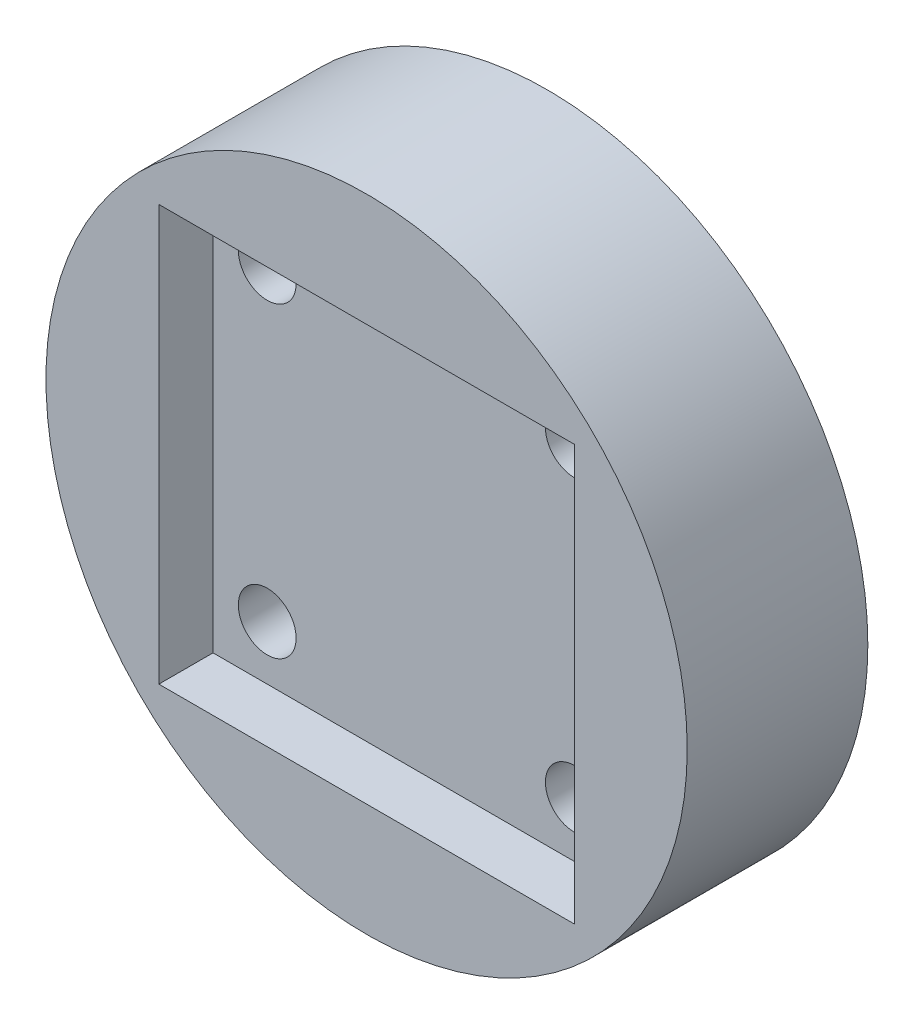
from build123d import *

# Parameters (mm, degrees)
SKETCH1_R           = 17.75
SKETCH1_W           = 23
SKETCH1_H           = 23
SKETCH1_R_2         = 1.6
BOSS_EXTRUDE1_DEPTH = 10
CUT_EXTRUDE1_START  = 10
SKETCH1_3_W         = 23
SKETCH1_3_H         = 23
SKETCH1_3_R         = 1.6
CUT_EXTRUDE1_DEPTH  = 3
SKETCH1_4_R         = 1.6
CUT_EXTRUDE3_DEPTH  = 28.020825302


with BuildPart() as part:
    # Sketch1 → Boss-Extrude1 (new body)
    # profile 1 of 6: a face of its own
    with BuildSketch(Plane(origin=(0, 0, 0), x_dir=(0, 1, 0), z_dir=(0, 0, 1))):
        with Locations(Location((0, 0, 0), (0, 0, 270))):
            Circle(SKETCH1_R)
        Rectangle(SKETCH1_W, SKETCH1_H, mode=Mode.SUBTRACT)
    # profile 2 of 6: a face of its own
    with BuildSketch(Plane(origin=(0, 0, 0), x_dir=(0, 1, 0), z_dir=(0, 0, 1))):
        Rectangle(SKETCH1_W, SKETCH1_H)
        with Locations((-8.5, -8.5)):
            Circle(SKETCH1_R_2, mode=Mode.SUBTRACT)
        with Locations((8.5, -8.5)):
            Circle(SKETCH1_R_2, mode=Mode.SUBTRACT)
        with Locations((8.5, 8.5)):
            Circle(SKETCH1_R_2, mode=Mode.SUBTRACT)
        with Locations((-8.5, 8.5)):
            Circle(SKETCH1_R_2, mode=Mode.SUBTRACT)
    # profile 3 of 6: a face of its own
    with BuildSketch(Plane(origin=(0, 0, 0), x_dir=(0, 1, 0), z_dir=(0, 0, 1))):
        with Locations((8.5, 8.5)):
            Circle(SKETCH1_R_2)
    # profile 4 of 6: a face of its own
    with BuildSketch(Plane(origin=(0, 0, 0), x_dir=(0, 1, 0), z_dir=(0, 0, 1))):
        with Locations((-8.5, 8.5)):
            Circle(SKETCH1_R_2)
    # profile 5 of 6: a face of its own
    with BuildSketch(Plane(origin=(0, 0, 0), x_dir=(0, 1, 0), z_dir=(0, 0, 1))):
        with Locations((8.5, -8.5)):
            Circle(SKETCH1_R_2)
    # profile 6 of 6: a face of its own
    with BuildSketch(Plane(origin=(0, 0, 0), x_dir=(0, 1, 0), z_dir=(0, 0, 1))):
        with Locations((-8.5, -8.5)):
            Circle(SKETCH1_R_2)
    extrude(amount=BOSS_EXTRUDE1_DEPTH)

    # Sketch1<3> → Cut-Extrude1 (cut)
    # profile 1 of 5: a face of its own
    with BuildSketch(Plane(origin=(0, 0, 0), x_dir=(0, 1, 0), z_dir=(0, 0, 1)).offset(CUT_EXTRUDE1_START)):
        Rectangle(SKETCH1_3_W, SKETCH1_3_H)
        with Locations((-8.5, -8.5)):
            Circle(SKETCH1_3_R, mode=Mode.SUBTRACT)
        with Locations((8.5, -8.5)):
            Circle(SKETCH1_3_R, mode=Mode.SUBTRACT)
        with Locations((8.5, 8.5)):
            Circle(SKETCH1_3_R, mode=Mode.SUBTRACT)
        with Locations((-8.5, 8.5)):
            Circle(SKETCH1_3_R, mode=Mode.SUBTRACT)
    # profile 2 of 5: a face of its own
    with BuildSketch(Plane(origin=(0, 0, 0), x_dir=(0, 1, 0), z_dir=(0, 0, 1)).offset(CUT_EXTRUDE1_START)):
        with Locations((-8.5, 8.5)):
            Circle(SKETCH1_3_R)
    # profile 3 of 5: a face of its own
    with BuildSketch(Plane(origin=(0, 0, 0), x_dir=(0, 1, 0), z_dir=(0, 0, 1)).offset(CUT_EXTRUDE1_START)):
        with Locations((8.5, 8.5)):
            Circle(SKETCH1_3_R)
    # profile 4 of 5: a face of its own
    with BuildSketch(Plane(origin=(0, 0, 0), x_dir=(0, 1, 0), z_dir=(0, 0, 1)).offset(CUT_EXTRUDE1_START)):
        with Locations((-8.5, -8.5)):
            Circle(SKETCH1_3_R)
    # profile 5 of 5: a face of its own
    with BuildSketch(Plane(origin=(0, 0, 0), x_dir=(0, 1, 0), z_dir=(0, 0, 1)).offset(CUT_EXTRUDE1_START)):
        with Locations((8.5, -8.5)):
            Circle(SKETCH1_3_R)
    extrude(amount=-CUT_EXTRUDE1_DEPTH, mode=Mode.SUBTRACT)

    # Sketch1<4> → Cut-Extrude3 (cut, through all)
    with BuildSketch(Plane(origin=(0, 0, 0), x_dir=(0, 1, 0), z_dir=(0, 0, 1))):
        with Locations(Location((-8.5, -8.5, 0), (0, 0, 90))):
            Circle(SKETCH1_4_R)
        with Locations(Location((8.5, -8.5, 0), (0, 0, 90))):
            Circle(SKETCH1_4_R)
        with Locations(Location((8.5, 8.5, 0), (0, 0, 90))):
            Circle(SKETCH1_4_R)
        with Locations(Location((-8.5, 8.5, 0), (0, 0, 90))):
            Circle(SKETCH1_4_R)
    extrude(amount=CUT_EXTRUDE3_DEPTH, mode=Mode.SUBTRACT)


solid = part.part
